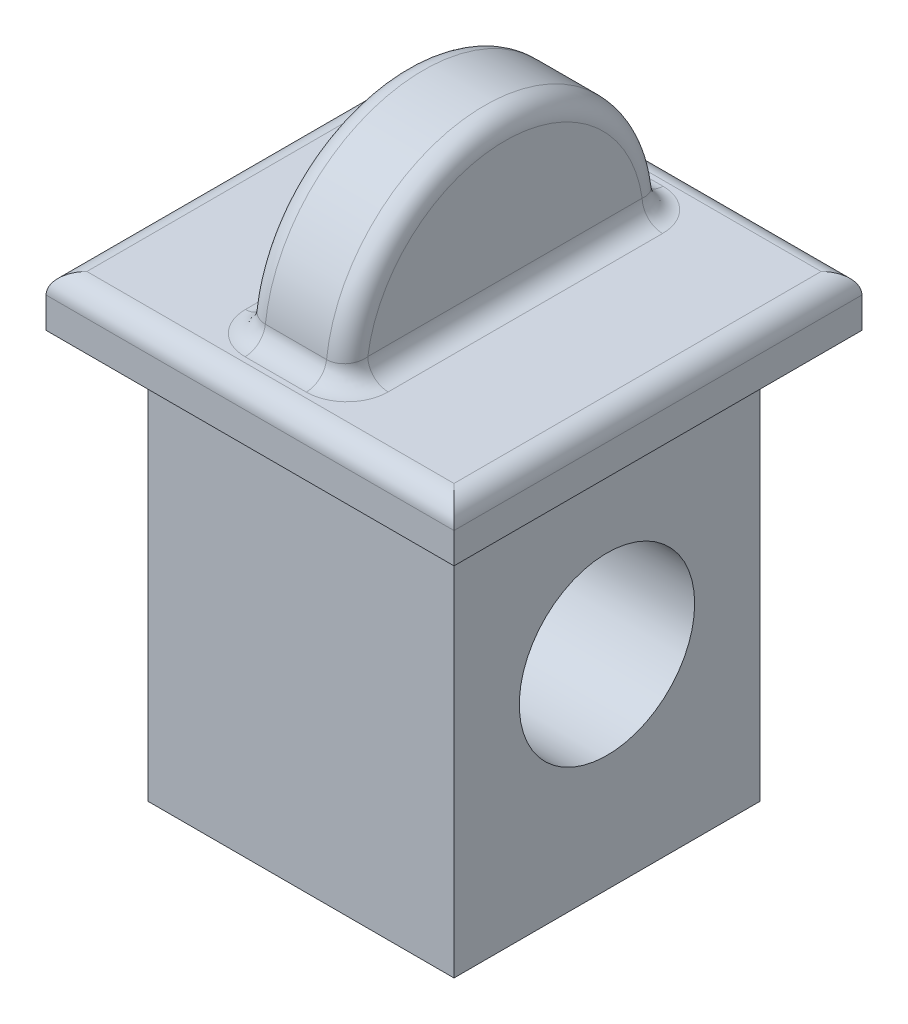
from build123d import *

# Parameters (mm, degrees)
SKETCH1_W           = 19.05
SKETCH1_H           = 19.05
BOSS_EXTRUDE1_DEPTH = 27.94
SKETCH2_W           = 25.4
SKETCH2_H           = 25.4
BOSS_EXTRUDE2_DEPTH = 3.175
SKETCH3_R           = 5.461
CUT_EXTRUDE1_DEPTH  = 41.291237881
SKETCH4_R           = 9.906
BOSS_EXTRUDE3_DEPTH = 3.175
FILLET1_R           = 1.27
CHAMFER1_SIZE       = 2.54


with BuildPart() as part:
    # Sketch1 → Boss-Extrude1 (new body)
    with BuildSketch(Plane(origin=(0, 0, 0), x_dir=(1, 0, 0), z_dir=(0, 1, 0))):
        Rectangle(SKETCH1_W, SKETCH1_H)
    extrude(amount=BOSS_EXTRUDE1_DEPTH)

    # Sketch2 → Boss-Extrude2 (add)
    with BuildSketch(Plane(origin=(0, 27.94, 0), x_dir=(1, 0, 0), z_dir=(0, 1, 0))):
        Rectangle(SKETCH2_W, SKETCH2_H)
    extrude(amount=BOSS_EXTRUDE2_DEPTH)

    # Sketch3 → Cut-Extrude1 (cut, through all)
    with BuildSketch(Plane(origin=(9.525, 0, 0), x_dir=(0, 0, -1), z_dir=(1, 0, 0))):
        with Locations((0, 15.24)):
            Circle(SKETCH3_R)
    extrude(amount=-CUT_EXTRUDE1_DEPTH, mode=Mode.SUBTRACT)

    # Sketch4 → Boss-Extrude3 (add, symmetric)
    with BuildSketch(Plane(origin=(0, 0, 0), x_dir=(0, 0, -1), z_dir=(1, 0, 0))):
        with Locations((0, 31.115)):
            Circle(SKETCH4_R)
    extrude(amount=BOSS_EXTRUDE3_DEPTH, both=True)

    # Fillet1
    fillet1_edges = [part.edges().sort_by_distance(p)[0] for p in [
        (0, 31.115, 12.7),
        (12.7, 31.115, 0),
        (0, 31.115, -12.7),
        (-12.7, 31.115, 0),
        (-3.175, 31.115, 0),
        (0, 31.115, 9.906),
        (0, 31.115, -9.906),
        (3.175, 31.115, 0),
        (-3.175, 41.021, 0),
        (3.175, 41.021, 0),
    ]]
    fillet(fillet1_edges, radius=FILLET1_R)

    # Chamfer1
    chamfer1_edges = [part.edges().sort_by_distance(p)[0] for p in [
        (0, 0, 9.525),
        (-9.525, 0, 0),
        (0, 0, -9.525),
        (9.525, 0, 0),
    ]]
    chamfer(chamfer1_edges, length=CHAMFER1_SIZE)


solid = part.part
